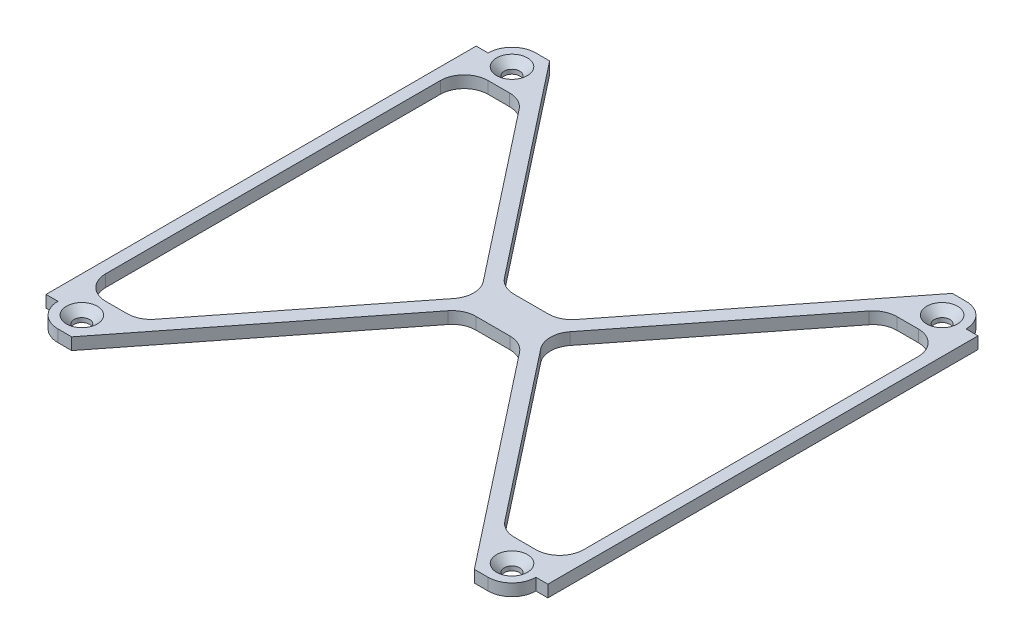
from build123d import *

# Parameters (mm, degrees)
SKETCH1_R           = 1.625
BOSS_EXTRUDE1_DEPTH = 2.5
FILLET1_R           = 5
FILLET2_R           = 5
CHAMFER1_SIZE       = 1.6


with BuildPart() as part:
    # Sketch1 → Boss-Extrude1 (new body)
    with BuildSketch(Plane(origin=(0, 0, 0), x_dir=(1, 0, 0), z_dir=(0, 1, 0))):
        with BuildLine():
            Line((-52.5, 45), (-52.5, -45))
            Line((-52.5, -45), (-50, -45))
            ThreePointArc((-50, -45), (-48.535533906, -48.535533906), (-45, -50))
            Line((-45, -50), (-42.127158908, -50))
            Line((-42.127158908, -50), (-6, -4))
            Line((-6, -4), (6, -4))
            Line((6, -4), (42.127158908, -50))
            Line((42.127158908, -50), (45, -50))
            ThreePointArc((45, -50), (48.535533906, -48.535533906), (50, -45))
            Line((50, -45), (52.5, -45))
            Line((52.5, -45), (52.5, 45))
            Line((52.5, 45), (50, 45))
            ThreePointArc((50, 45), (48.535533906, 48.535533906), (45, 50))
            Line((45, 50), (42.127158908, 50))
            Line((42.127158908, 50), (6, 4))
            Line((6, 4), (-6, 4))
            Line((-6, 4), (-42.127158908, 50))
            Line((-42.127158908, 50), (-45, 50))
            ThreePointArc((-45, 50), (-48.535533906, 48.535533906), (-50, 45))
            Line((-50, 45), (-52.5, 45))
        make_face()
        with Locations(Location((-45, 45, 0), (0, 0, 270))):
            Circle(SKETCH1_R, mode=Mode.SUBTRACT)
        with Locations(Location((45, 45, 0), (0, 0, 270))):
            Circle(SKETCH1_R, mode=Mode.SUBTRACT)
        with Locations(Location((-45, -45, 0), (0, 0, 270))):
            Circle(SKETCH1_R, mode=Mode.SUBTRACT)
        with Locations(Location((45, -45, 0), (0, 0, 270))):
            Circle(SKETCH1_R, mode=Mode.SUBTRACT)
        Polygon((-50, 40), (-50, -40), (-38.088044946, -40), (-6.673124156, 0), (-38.088044946, 40), align=None, mode=Mode.SUBTRACT)
        Polygon((50, -40), (38.088044946, -40), (6.673124156, 0), (38.088044946, 40), (50, 40), align=None, mode=Mode.SUBTRACT)
    extrude(amount=BOSS_EXTRUDE1_DEPTH)

    # Fillet1
    fillet1_edges = [part.edges().sort_by_distance(p)[0] for p in [
        (-6, 1.25, -4),
        (6, 1.25, -4),
        (6, 1.25, 4),
        (-6, 1.25, 4),
        (-6.673124156, 1.25, 0),
        (6.673124156, 1.25, 0),
    ]]
    fillet(fillet1_edges, radius=FILLET1_R)

    # Fillet2
    fillet2_edges = [part.edges().sort_by_distance(p)[0] for p in [
        (-38.088044946, 1.25, -40),
        (-50, 1.25, -40),
        (-50, 1.25, 40),
        (-38.088044946, 1.25, 40),
        (50, 1.25, 40),
        (50, 1.25, -40),
        (38.088044946, 1.25, -40),
        (38.088044946, 1.25, 40),
    ]]
    fillet(fillet2_edges, radius=FILLET2_R)

    # Chamfer1
    chamfer1_edges = [part.edges().sort_by_distance(p)[0] for p in [
        (-45, 2.5, -46.625),
        (45, 2.5, -46.625),
        (-45, 2.5, 43.375),
        (45, 2.5, 43.375),
    ]]
    chamfer(chamfer1_edges, length=CHAMFER1_SIZE)


solid = part.part
